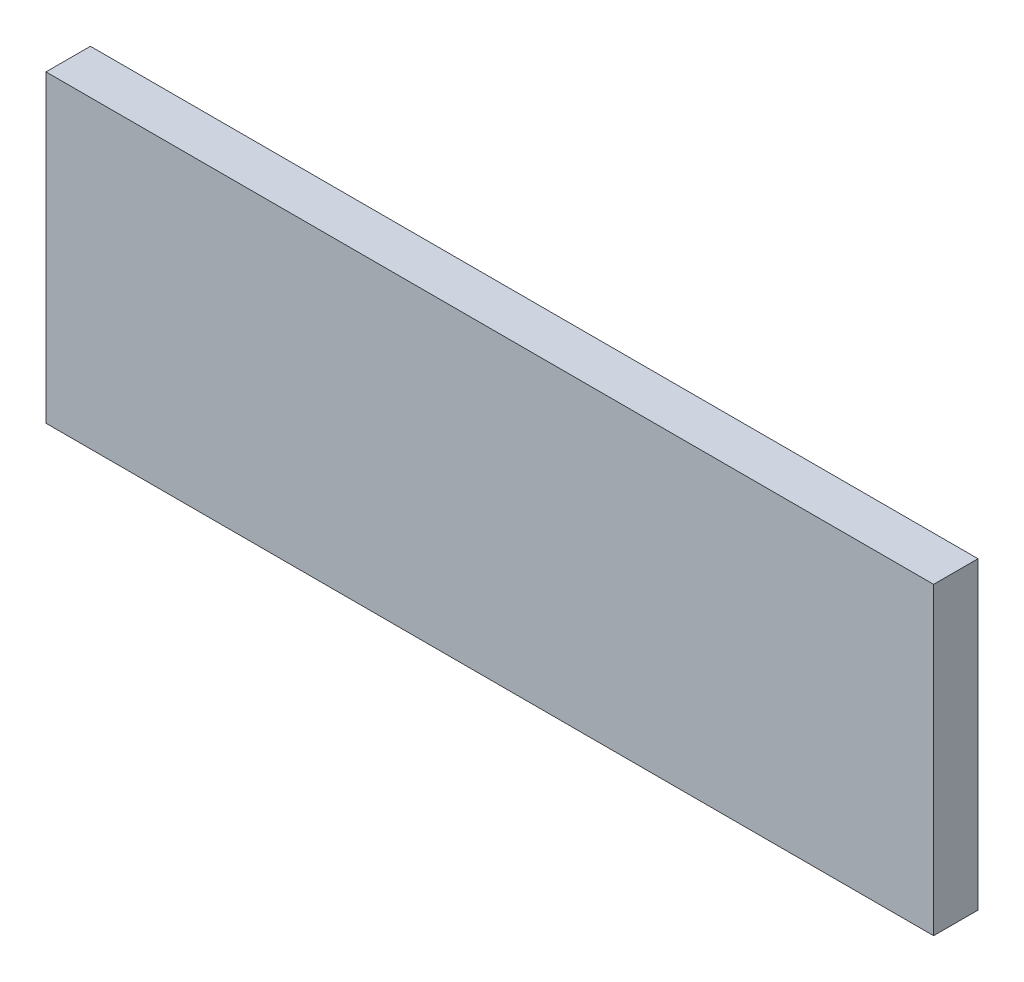
from build123d import *

# Parameters (mm, degrees)
IZIM1_W                     = 35
IZIM1_H                     = 12
Y_KSEKLIK_EKSTR_ZYON1_DEPTH = 1.75


with BuildPart() as part:
    # Çizim1 → Yükseklik-Ekstrüzyon1 (new body)
    with BuildSketch(Plane.XY):
        with Locations((17.5, 6)):
            Rectangle(IZIM1_W, IZIM1_H)
    extrude(amount=Y_KSEKLIK_EKSTR_ZYON1_DEPTH)


solid = part.part
